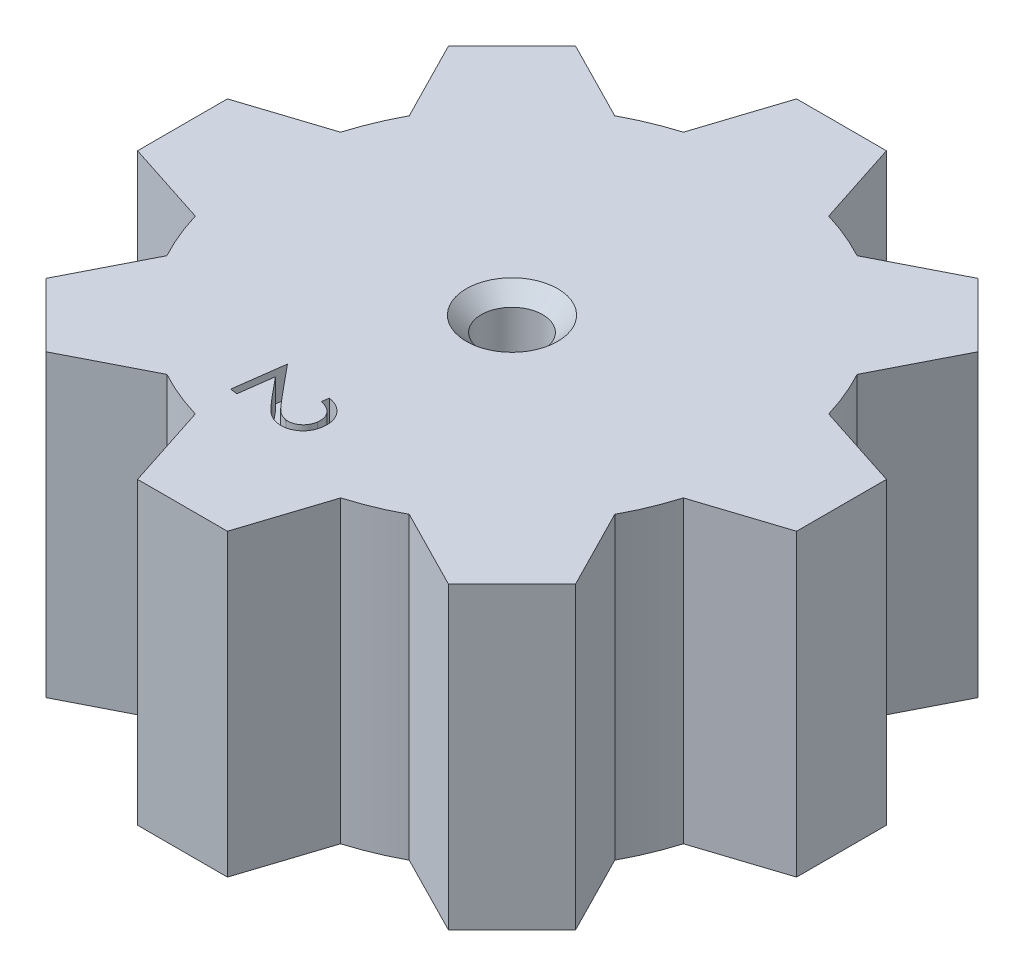
from build123d import *

# Parameters (mm, degrees)
SKETCH1_R           = 1.025
BOSS_EXTRUDE1_DEPTH = 10
CUT_EXTRUDE1_DEPTH  = 1
CHAMFER1_SIZE       = 0.5


with BuildPart() as part:
    # Sketch1 → Boss-Extrude1 (new body)
    with BuildSketch(Plane(origin=(0, 0, 0), x_dir=(1, 0, 0), z_dir=(0, 1, 0))):
        with BuildLine():
            Line((-1.5, 11), (1.5, 11))
            Line((1.5, 11), (2.425924848, 8.146464793))
            ThreePointArc((2.425924848, 8.146464793), (3.252809175, 7.852976026), (4.045032587, 7.475808409))
            Line((4.045032587, 7.475808409), (6.717514421, 8.838834765))
            Line((6.717514421, 8.838834765), (8.838834765, 6.717514421))
            Line((8.838834765, 6.717514421), (7.475808409, 4.045032587))
            ThreePointArc((7.475808409, 4.045032587), (7.852976026, 3.252809175), (8.146464793, 2.425924848))
            Line((8.146464793, 2.425924848), (11, 1.5))
            Line((11, 1.5), (11, -1.5))
            Line((11, -1.5), (8.146464793, -2.425924848))
            ThreePointArc((8.146464793, -2.425924848), (7.852976026, -3.252809175), (7.475808409, -4.045032587))
            Line((7.475808409, -4.045032587), (8.838834765, -6.717514421))
            Line((8.838834765, -6.717514421), (6.717514421, -8.838834765))
            Line((6.717514421, -8.838834765), (4.045032587, -7.475808409))
            ThreePointArc((4.045032587, -7.475808409), (3.252809175, -7.852976026), (2.425924848, -8.146464793))
            Line((2.425924848, -8.146464793), (1.5, -11))
            Line((1.5, -11), (-1.5, -11))
            Line((-1.5, -11), (-2.425924848, -8.146464793))
            ThreePointArc((-2.425924848, -8.146464793), (-3.252809175, -7.852976026), (-4.045032587, -7.475808409))
            Line((-4.045032587, -7.475808409), (-6.717514421, -8.838834765))
            Line((-6.717514421, -8.838834765), (-8.838834765, -6.717514421))
            Line((-8.838834765, -6.717514421), (-7.475808409, -4.045032587))
            ThreePointArc((-7.475808409, -4.045032587), (-7.852976026, -3.252809175), (-8.146464793, -2.425924848))
            Line((-8.146464793, -2.425924848), (-11, -1.5))
            Line((-11, -1.5), (-11, 1.5))
            Line((-11, 1.5), (-8.146464793, 2.425924848))
            ThreePointArc((-8.146464793, 2.425924848), (-7.852976026, 3.252809175), (-7.475808409, 4.045032587))
            Line((-7.475808409, 4.045032587), (-8.838834765, 6.717514421))
            Line((-8.838834765, 6.717514421), (-6.717514421, 8.838834765))
            Line((-6.717514421, 8.838834765), (-4.045032587, 7.475808409))
            ThreePointArc((-4.045032587, 7.475808409), (-3.252809175, 7.852976026), (-2.425924848, 8.146464793))
            Line((-2.425924848, 8.146464793), (-1.5, 11))
        make_face()
        with Locations(Location((0, 0, 0), (0, 0, 270))):
            Circle(SKETCH1_R, mode=Mode.SUBTRACT)
    extrude(amount=BOSS_EXTRUDE1_DEPTH)

    # Sketch2 → Cut-Extrude1 (cut)
    with BuildSketch(Plane(origin=(0, 10, 0), x_dir=(1, 0, 0), z_dir=(0, 1, 0))):
        with BuildLine():
            Line((-0.67951288, -5.685173621), (-0.647962399, -5.449296217))
            add(Edge.make_bspline(
                [(-0.647962399, -5.449296217), (-0.618308174, -5.454820304), (-0.560284153, -5.465629209), (-0.476362431, -5.48984076), (-0.397731022, -5.521051701), (-0.323681884, -5.55793727), (-0.2551006, -5.601861634), (-0.191688594, -5.652375632), (-0.132801937, -5.708925264), (-0.0801525, -5.772097211), (-0.033306561, -5.838981745), (0.006196757, -5.909238602), (0.037797909, -5.981878785), (0.061604112, -6.057047051), (0.077052172, -6.134660608), (0.08492264, -6.214640896), (0.085830566, -6.29719701), (0.079775803, -6.352610008), (0.076697056, -6.380786602)],
                knots=[0, 0, 0, 0, 1.100859962, 2.154037817, 3.182825855, 4.185872747, 5.169851411, 6.150256119, 7.141625092, 8.14517181, 9.147774204, 10.119215176, 11.08276616, 12.034993632, 12.992414738, 13.96637616, 14.965935861, 16, 16, 16, 16], degree=3))
            add(Edge.make_bspline(
                [(0.076697056, -6.380786602), (0.072393378, -6.408440649), (0.063964293, -6.462603227), (0.04245955, -6.540444475), (0.015673176, -6.613601341), (-0.018163052, -6.681449321), (-0.057782709, -6.744623459), (-0.104369947, -6.802540115), (-0.156916189, -6.855759765), (-0.215482247, -6.903032984), (-0.277774366, -6.944150039), (-0.342035354, -6.979710839), (-0.408235726, -7.007659397), (-0.475930945, -7.029042638), (-0.545273153, -7.043093792), (-0.616231572, -7.049848725), (-0.688708826, -7.050812711), (-0.737134817, -7.045523091), (-0.76164429, -7.042845897)],
                knots=[0, 0, 0, 0, 1.125087727, 2.203570911, 3.242694659, 4.254840133, 5.247912274, 6.236956909, 7.238958616, 8.25110409, 9.25878367, 10.238550544, 11.20150929, 12.144591564, 13.090252789, 14.041833295, 15.008928189, 16, 16, 16, 16], degree=3))
            add(Edge.make_bspline(
                [(-0.76164429, -7.042845897), (-0.795911856, -7.037073204), (-0.863853491, -7.025627798), (-0.961802832, -6.992522173), (-1.055166763, -6.948613121), (-1.128556526, -6.900437931), (-1.18688245, -6.854457889), (-1.234181818, -6.813349399), (-1.285078121, -6.766197674), (-1.338253587, -6.711815369), (-1.395526889, -6.651708318), (-1.456041505, -6.585144653), (-1.519640402, -6.511855414), (-1.562672338, -6.460481627), (-1.584961598, -6.433871538)],
                knots=[0, 0, 0, 0, 1.188707215, 2.356826555, 3.52825813, 4.714611235, 5.354043377, 6.071637886, 6.860592227, 7.729914435, 8.676361207, 9.70450881, 10.811004006, 12, 12, 12, 12], degree=3))
            Line((-1.584961598, -6.433871538), (-2.164889482, -5.732248942))
            Line((-2.164889482, -5.732248942), (-2.316632271, -6.869067852))
            Line((-2.316632271, -6.869067852), (-2.55451288, -6.837517371))
            Line((-2.55451288, -6.837517371), (-2.331155508, -5.164841089))
            Line((-2.331155508, -5.164841089), (-1.440230027, -6.241563846))
            add(Edge.make_bspline(
                [(-1.440230027, -6.241563846), (-1.418649822, -6.267874505), (-1.377249469, -6.318349956), (-1.315768194, -6.38934036), (-1.259427886, -6.454151648), (-1.206885587, -6.511815526), (-1.158177578, -6.562464113), (-1.114045746, -6.606526292), (-1.073683056, -6.643345812), (-1.026325868, -6.683346431), (-0.967044732, -6.723557397), (-0.892856227, -6.760623309), (-0.81553634, -6.788990522), (-0.761683927, -6.797953641), (-0.734601021, -6.802461281)],
                knots=[0, 0, 0, 0, 1.32529596, 2.542502302, 3.657515733, 4.670000406, 5.580482446, 6.394245158, 7.098391746, 7.707758491, 8.807790529, 9.877823122, 10.932736443, 12, 12, 12, 12], degree=3))
            add(Edge.make_bspline(
                [(-0.734601021, -6.802461281), (-0.717426635, -6.80438222), (-0.68363806, -6.80816144), (-0.633127366, -6.806556794), (-0.583869632, -6.801558493), (-0.535919132, -6.790163413), (-0.489098591, -6.774099208), (-0.443345088, -6.752865521), (-0.398672819, -6.726802578), (-0.35592185, -6.695740886), (-0.315566891, -6.661189714), (-0.279504864, -6.622950363), (-0.247530448, -6.582201059), (-0.220631343, -6.538310443), (-0.197234923, -6.492062695), (-0.178790476, -6.442668271), (-0.164583049, -6.390524125), (-0.15900309, -6.354480024), (-0.15617554, -6.336215288)],
                knots=[0, 0, 0, 0, 1.002635519, 1.972567043, 2.928877794, 3.874508698, 4.828259305, 5.800176361, 6.799758996, 7.8278638, 8.866026664, 9.881245134, 10.876349012, 11.869324323, 12.866787948, 13.882608331, 14.927047686, 16, 16, 16, 16], degree=3))
            add(Edge.make_bspline(
                [(-0.15617554, -6.336215288), (-0.15395807, -6.316878514), (-0.149590127, -6.278789182), (-0.149692165, -6.222212083), (-0.155357805, -6.167410823), (-0.165690288, -6.114526465), (-0.181382515, -6.063304443), (-0.202439411, -6.014053189), (-0.229260456, -5.966903638), (-0.260809506, -5.921672896), (-0.297362541, -5.879390265), (-0.338000583, -5.839781192), (-0.384025516, -5.804833072), (-0.434318992, -5.773209858), (-0.489037939, -5.745030253), (-0.548513417, -5.721234969), (-0.612167638, -5.700363512), (-0.656711876, -5.690316446), (-0.67951288, -5.685173621)],
                knots=[0, 0, 0, 0, 1.003940432, 1.977549207, 2.912892054, 3.843939206, 4.754223491, 5.672869237, 6.602639779, 7.549185681, 8.514563016, 9.483432891, 10.472624027, 11.490954394, 12.546793215, 13.644379156, 14.7942207, 16, 16, 16, 16], degree=3))
        make_face()
    extrude(amount=-CUT_EXTRUDE1_DEPTH, mode=Mode.SUBTRACT)

    # Chamfer1
    chamfer1_edges = [part.edges().sort_by_distance(p)[0] for p in [
        (0, 10, -1.025),
    ]]
    chamfer(chamfer1_edges, length=CHAMFER1_SIZE)


solid = part.part
